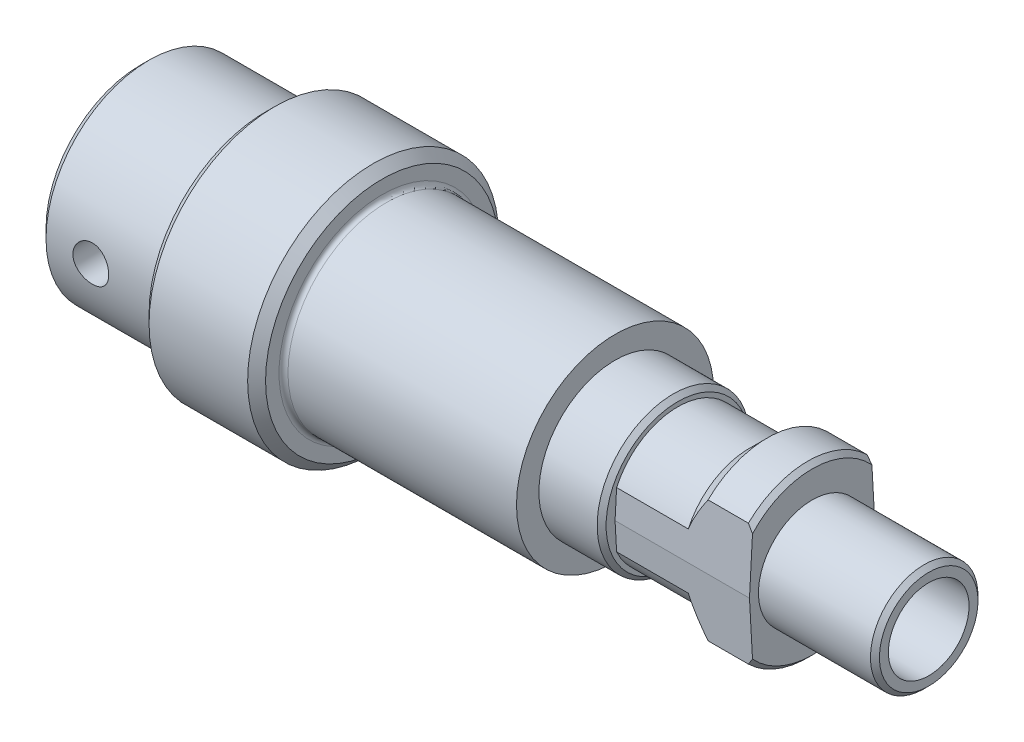
from build123d import *

# Parameters (mm, degrees)
CHANFREIN1_SIZE         = 1
CONG_1_R                = 0.5
CHANFREIN2_SIZE         = 0.5
ENL_V_MAT_EXTRU_1_DEPTH = 15
CHANFREIN3_SIZE         = 0.5
ESQUISSE3_R             = 2
ENL_V_MAT_EXTRU_2_DEPTH = 96.372952141


with BuildPart() as part:
    # Esquisse1 → Base-Révolution (revolve)
    with BuildSketch(Plane.XY, mode=Mode.PRIVATE) as base_r_volution_sk:
        Polygon((0, 4.5), (0, 6), (-13, 6), (-13, 9.5), (-18, 9.5), (-20, 7.5), (-28, 7.5), (-28, 8), (-28.5, 8.5), (-35, 8.5), (-35, 11), (-61, 11), (-61, 14), (-74, 14), (-74, 11.5), (-88, 11.5), (-88, 8.5), (-76, 8.5), (-76, 6), (-66, 6), (-66, 4.5), align=None)
    revolve(base_r_volution_sk.sketch.rotate(Axis((11, 0, 0), (-1, 0, 0)), 90), axis=Axis((11, 0, 0), (-1, 0, 0)))

    # Chanfrein1
    chanfrein1_edges = [part.edges().sort_by_distance(p)[0] for p in [
        (-61, 0, 14),
        (-74, 0, 14),
        (-88, 0, 11.5),
    ]]
    chamfer(chanfrein1_edges, length=CHANFREIN1_SIZE)

    # Congé1
    cong_1_edges = [part.edges().sort_by_distance(p)[0] for p in [
        (-61, 0, 11),
    ]]
    fillet(cong_1_edges, radius=CONG_1_R)

    # Chanfrein2
    chanfrein2_edges = [part.edges().sort_by_distance(p)[0] for p in [
        (-88, 0, 8.5),
        (-76, 0, 6),
        (0, 0, 6),
        (-66, 0, 4.5),
    ]]
    chamfer(chanfrein2_edges, length=CHANFREIN2_SIZE)

    # Esquisse2 → Enlèv. mat.-Extru.1 (cut)
    with BuildSketch(Plane(origin=(-13, 0, 0), x_dir=(0, 0, -1), z_dir=(1, 0, 0))):
        Polygon((-7, 0), (-6.5, 9), (-14, 9), (-14, -9), (-6.5, -9), align=None)
        Polygon((14, -9), (6.5, -9), (7, 0), (6.5, 9), (14, 9), align=None)
    extrude(amount=-ENL_V_MAT_EXTRU_1_DEPTH, mode=Mode.SUBTRACT)

    # Chanfrein3
    chanfrein3_edges = [part.edges().sort_by_distance(p)[0] for p in [
        (-13, 9.5, 0),
        (-13, -9.5, 0),
    ]]
    chamfer(chanfrein3_edges, length=CHANFREIN3_SIZE)

    # Esquisse3 → Enlèv. mat.-Extru.2 (cut, through all)
    with BuildSketch(Plane.XY.offset(20)):
        with Locations((-82, 0)):
            Circle(ESQUISSE3_R)
    extrude(amount=-ENL_V_MAT_EXTRU_2_DEPTH, mode=Mode.SUBTRACT)


solid = part.part
